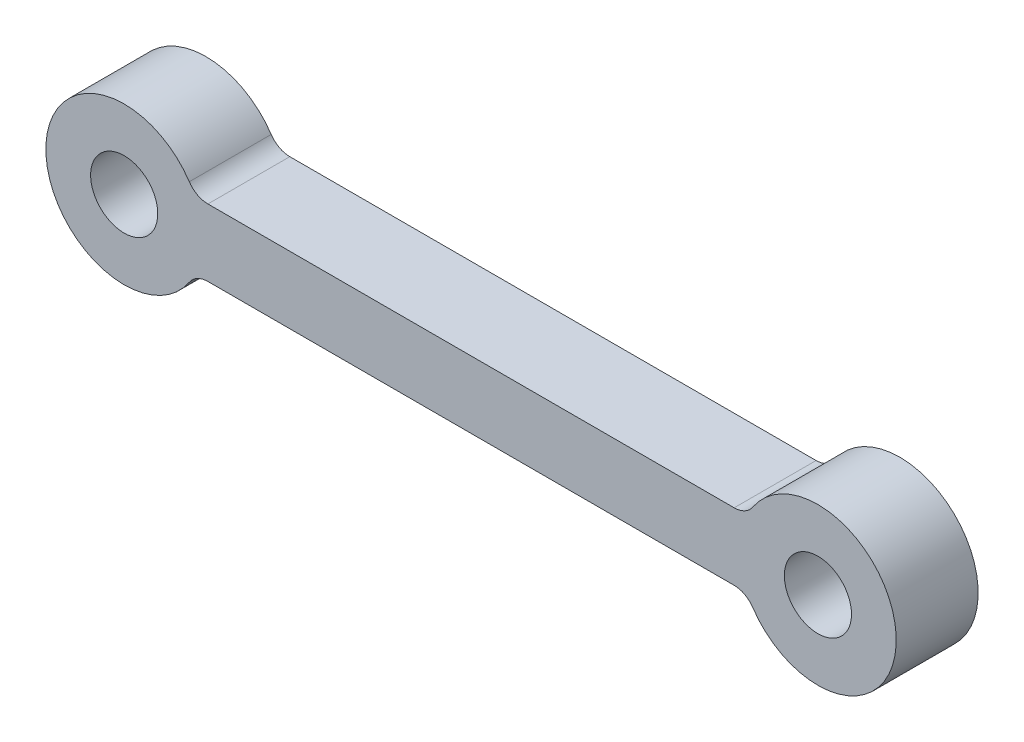
from build123d import *

# Parameters (mm, degrees)
SKETCH1_R           = 1.5
BOSS_EXTRUDE1_DEPTH = 1.83
FILLET1_R           = 1


with BuildPart() as part:
    # Sketch1 → Boss-Extrude1 (new, symmetric)
    # profile 1 of 3: a face of its own
    with BuildSketch(Plane.XY):
        with BuildLine():
            ThreePointArc((-12, 0), (-12.085474, 0.768774), (-12.337722, 1.5))
            ThreePointArc((-12.337722, 1.5), (-19, 0), (-12.337722, -1.5))
            ThreePointArc((-12.337722, -1.5), (-12.085474, -0.768774), (-12, 0))
        make_face()
        with Locations((-15.5, 0)):
            Circle(SKETCH1_R, mode=Mode.SUBTRACT)
    # profile 2 of 3: a face of its own
    with BuildSketch(Plane.XY):
        with BuildLine():
            Line((12.337722, 1.5), (-12.337722, 1.5))
            ThreePointArc((-12.337722, 1.5), (-12.085474, 0.768774), (-12, 0))
            ThreePointArc((-12, 0), (-12.085474, -0.768774), (-12.337722, -1.5))
            Line((-12.337722, -1.5), (12.337722, -1.5))
            ThreePointArc((12.337722, -1.5), (12, 0), (12.337722, 1.5))
        make_face()
    # profile 3 of 3: a face of its own
    with BuildSketch(Plane.XY):
        with BuildLine():
            ThreePointArc((19, 0), (16.268774, 3.414526), (12.337722, 1.5))
            ThreePointArc((12.337722, 1.5), (12, 0), (12.337722, -1.5))
            ThreePointArc((12.337722, -1.5), (16.268774, -3.414526), (19, 0))
        make_face()
        with Locations((15.5, 0)):
            Circle(SKETCH1_R, mode=Mode.SUBTRACT)
    extrude(amount=BOSS_EXTRUDE1_DEPTH, both=True)

    # Fillet1
    fillet1_edges = [part.edges().sort_by_distance(p)[0] for p in [
        (-12.337722, 1.5, 0),
        (12.337722, 1.5, 0.915),
        (12.337722, -1.5, 0.915),
        (-12.337722, -1.5, 0),
    ]]
    fillet(fillet1_edges, radius=FILLET1_R)


solid = part.part
